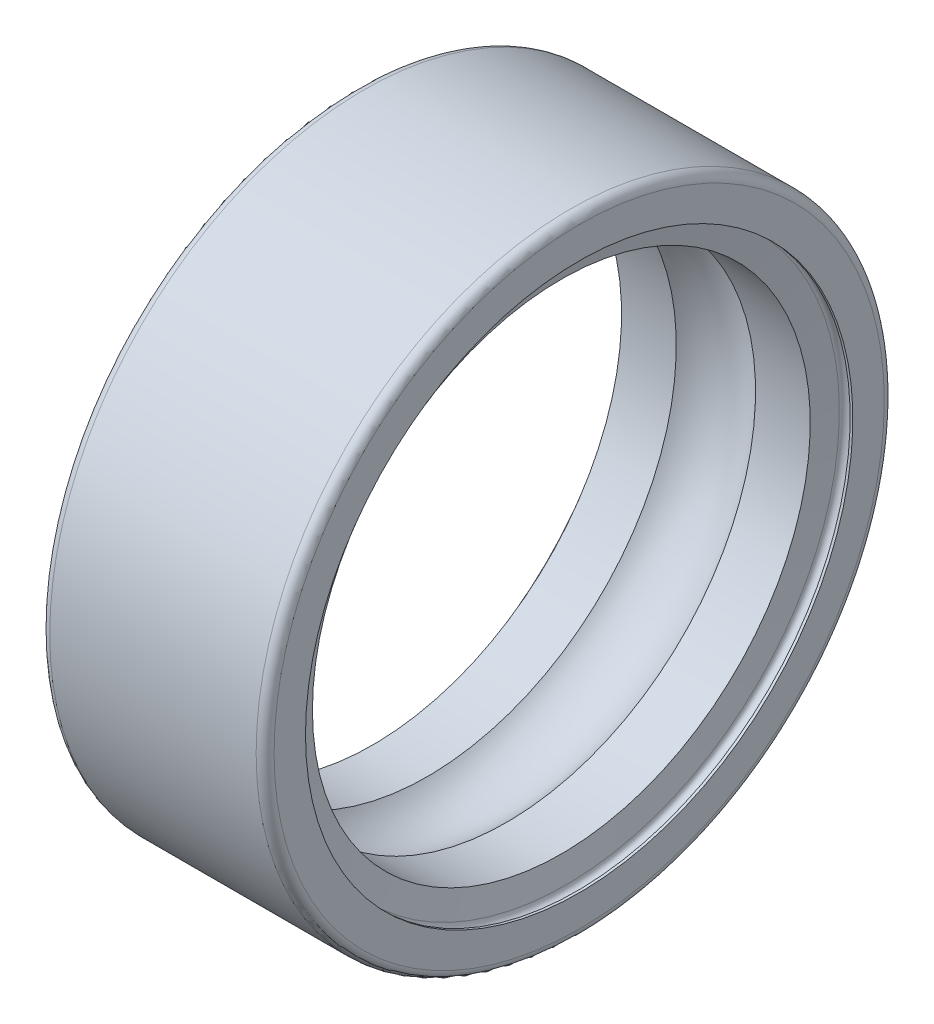
from build123d import *


with BuildPart() as part:
    # Sketch1 → Revolve1 (revolve)
    with BuildSketch(Plane.XY, mode=Mode.PRIVATE) as revolve1_sk:
        with BuildLine():
            Line((0, 6.8), (0, 6.1))
            Line((0, 6.1), (0.06, 6.1))
            ThreePointArc((0.06, 6.1), (0.18, 6.22), (0.3, 6.1))
            Line((0.3, 6.1), (0.397332493, 5.548))
            Line((0.397332493, 5.548), (1.616548671, 5.548))
            ThreePointArc((1.616548671, 5.548), (2.5, 5.9405), (3.383451329, 5.548))
            Line((3.383451329, 5.548), (4.602667507, 5.548))
            Line((4.602667507, 5.548), (4.7, 6.1))
            ThreePointArc((4.7, 6.1), (4.82, 6.22), (4.94, 6.1))
            Line((4.94, 6.1), (5, 6.1))
            Line((5, 6.1), (5, 6.8))
            ThreePointArc((5, 6.8), (4.941421356, 6.941421356), (4.8, 7))
            Line((4.8, 7), (0.2, 7))
            ThreePointArc((0.2, 7), (0.058578644, 6.941421356), (0, 6.8))
        make_face()
    revolve(revolve1_sk.sketch.rotate(Axis((50, 0, 0), (-1, 0, 0)), 270), axis=Axis((50, 0, 0), (-1, 0, 0)))


solid = part.part
